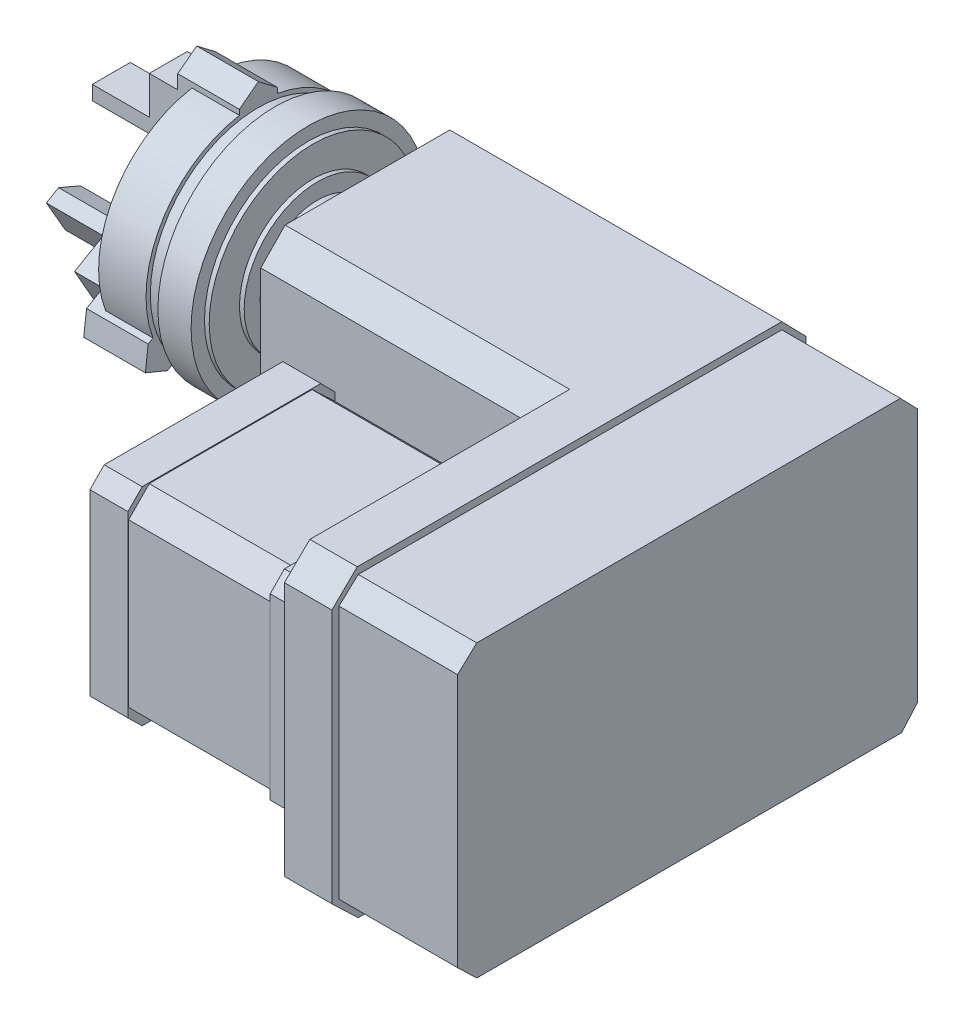
from build123d import *

# Parameters (mm, degrees)
BOSS_EXTRUDE1_DEPTH    = 60
CUT_EXTRUDE1_DEPTH     = 121.037494142
BOSS_EXTRUDE5_DEPTH    = 10
BOSS_EXTRUDE6_DEPTH    = 25
BOSS_EXTRUDE7_DEPTH    = 8
BOSS_EXTRUDE8_DEPTH    = 30
BOSS_EXTRUDE9_DEPTH    = 8
SKETCH8_R              = 4.044381725
CUT_EXTRUDE2_DEPTH     = 5
SKETCH9_R              = 15.487315424
CUT_EXTRUDE3_DEPTH     = 0.5
SKETCH10_R             = 11.178262473
BOSS_EXTRUDE10_DEPTH   = 3
SKETCH11_R             = 12.137000118
BOSS_EXTRUDE11_DEPTH   = 8
BOSS_EXTRUDE12_START   = 1
SKETCH12_R             = 15.487315424
BOSS_EXTRUDE12_DEPTH   = 1
SKETCH13_R             = 21.870620662
BOSS_EXTRUDE13_DEPTH   = 1
SKETCH14_R             = 24.68912304
BOSS_EXTRUDE14_DEPTH   = 7
SKETCH15_R             = 22.788184892
BOSS_EXTRUDE15_DEPTH   = 3.5
BOSS_EXTRUDE17_DEPTH   = 10
BOSS_EXTRUDE18_DEPTH   = 25
CUT_EXTRUDE4_DEPTH     = 12
CUT_EXTRUDE5_DEPTH     = 12
SKETCH20_W             = 8
SKETCH20_H             = 8
CUT_EXTRUDE6_DEPTH     = 6
BOSS_EXTRUDE19_DEPTH   = 12
BOSS_EXTRUDE19_2_DEPTH = 12
BOSS_EXTRUDE19_3_DEPTH = 12
CUT_EXTRUDE7_DEPTH     = 12
CUT_EXTRUDE8_DEPTH     = 1
CUT_EXTRUDE9_DEPTH     = 1
BOSS_EXTRUDE20_DEPTH   = 6


with BuildPart() as part:
    # Sketch1 → Boss-Extrude1 (new body)
    with BuildSketch(Plane(origin=(0, 0, 0), x_dir=(0, 0, -1), z_dir=(1, 0, 0))):
        Polygon((0, 8), (0, 0), (18.000733745, 0), (22.844437025, 5.141795141), (51.906656706, 5.141795141), (57, 0), (75, 0), (75, 8), (60, 8), (60, 66.734849184), (54.858204859, 72), (20.141795141, 72), (15, 66.734849184), (15, 8), align=None)
    extrude(amount=BOSS_EXTRUDE1_DEPTH)

    # Sketch2 → Cut-Extrude1 (cut, through all)
    with BuildSketch(Plane.XZ):
        with BuildLine():
            Line((55, -8), (55, 0))
            Line((55, 0), (47, 0))
            Line((47, 0), (47, -8))
            ThreePointArc((47, -8), (51, -12), (55, -8))
        make_face()
        with BuildLine():
            Line((13, 0), (5, 0))
            Line((5, 0), (5, -8))
            ThreePointArc((5, -8), (9, -12), (13, -8))
            Line((13, -8), (13, 0))
        make_face()
        with BuildLine():
            Line((47, -75), (55, -75))
            Line((55, -75), (55, -67))
            ThreePointArc((55, -67), (51, -63), (47, -67))
            Line((47, -67), (47, -75))
        make_face()
        with BuildLine():
            Line((5, -75), (13, -75))
            Line((13, -75), (13, -67))
            ThreePointArc((13, -67), (9, -63), (5, -67))
            Line((5, -67), (5, -75))
        make_face()
    extrude(amount=-CUT_EXTRUDE1_DEPTH, mode=Mode.SUBTRACT)

    # Sketch3 → Boss-Extrude5 (add)
    with BuildSketch(Plane(origin=(60, 0, 0), x_dir=(0, 0, -1), z_dir=(1, 0, 0))):
        Polygon((-40, 13.130427758), (-34.454678746, 7.813729324), (55.132936848, 7.813729324), (60, 13.21926496), (60, 66.734849184), (54.858204859, 72), (-34.64895923, 72), (-40, 66.774327195), align=None)
    extrude(amount=BOSS_EXTRUDE5_DEPTH)

    # Sketch4 → Boss-Extrude6 (add)
    with BuildSketch(Plane(origin=(70, 0, 0), x_dir=(0, 0, -1), z_dir=(1, 0, 0))):
        Polygon((-25.698394905, 70.5), (54.858204859, 70.5), (58.5, 66.734849184), (58.5, 39.977057072), (58.5, 13.21926496), (55.132936848, 9.313729324), (22.74008343, 9.313729324), (-34.454678746, 9.313729324), (-38.5, 13.21926496), (-38.5, 39.952377476), (-38.5, 66.734849184), (-34.454678746, 70.5), align=None)
    extrude(amount=BOSS_EXTRUDE6_DEPTH)

    # Sketch5 → Boss-Extrude7 (add)
    with BuildSketch(Plane.ZY.offset(-60)):
        Polygon((35, 20.563642038), (35, 58.244850637), (32, 61.296911147), (27.576585988, 61.296911147), (-5.67, 61.296911147), (-8.67, 58.244850637), (-8.67, 20.563642038), (-5.67, 17.628968471), (23.350656051, 17.628968471), (32, 17.628968471), align=None)
    extrude(amount=BOSS_EXTRUDE7_DEPTH)

    # Sketch6 → Boss-Extrude8 (add)
    with BuildSketch(Plane.ZY.offset(-52)):
        Polygon((34.858186176, 22.424916278), (34.858186176, 56.68012364), (30.510716808, 61.103036832), (-3.83089655, 61.103036832), (-8.528186176, 56.669693972), (-8.528186176, 22.424916278), (-3.871605337, 17.869734711), (30.201605337, 17.869734711), align=None)
    extrude(amount=BOSS_EXTRUDE8_DEPTH)

    # Sketch7 → Boss-Extrude9 (add)
    with BuildSketch(Plane.ZY.offset(-22)):
        Polygon((-8.67, 58.244850637), (-5.67, 61.296911147), (32, 61.296911147), (35, 58.244850637), (35, 20.563642038), (32, 17.628968471), (-5.67, 17.628968471), (-8.67, 20.563642038), align=None)
    extrude(amount=BOSS_EXTRUDE9_DEPTH)

    # Sketch8 → Cut-Extrude2 (cut)
    with BuildSketch(Plane.ZY.offset(-14)):
        with Locations((13.165, 39.404246338)):
            Circle(SKETCH8_R)
    extrude(amount=-CUT_EXTRUDE2_DEPTH, mode=Mode.SUBTRACT)

    # Sketch9 → Cut-Extrude3 (cut)
    with BuildSketch(Plane.ZY):
        with Locations((-37.5, 50.497312421)):
            Circle(SKETCH9_R)
    extrude(amount=-CUT_EXTRUDE3_DEPTH, mode=Mode.SUBTRACT)

    # Sketch10 → Boss-Extrude10 (add)
    with BuildSketch(Plane.ZY.offset(-0.5)):
        with Locations((-37.5, 50.497312421)):
            Circle(SKETCH10_R)
    extrude(amount=BOSS_EXTRUDE10_DEPTH)

    # Sketch11 → Boss-Extrude11 (add)
    with BuildSketch(Plane.ZY.offset(2.5)):
        with Locations((-37.5, 50.497312421)):
            Circle(SKETCH11_R)
    extrude(amount=BOSS_EXTRUDE11_DEPTH)

    # Sketch12 → Boss-Extrude12 (add)
    with BuildSketch(Plane.ZY.offset(10.5).offset(BOSS_EXTRUDE12_START)):
        with Locations((-37.5, 50.497312421)):
            Circle(SKETCH12_R)
    extrude(amount=-BOSS_EXTRUDE12_DEPTH)

    # Sketch13 → Boss-Extrude13 (add)
    with BuildSketch(Plane.ZY.offset(11.5)):
        with Locations((-37.5, 50.497312421)):
            Circle(SKETCH13_R)
    extrude(amount=BOSS_EXTRUDE13_DEPTH)

    # Sketch14 → Boss-Extrude14 (add)
    with BuildSketch(Plane.ZY.offset(12.5)):
        with Locations((-37.5, 50.497312421)):
            Circle(SKETCH14_R)
    extrude(amount=BOSS_EXTRUDE14_DEPTH)

    # Sketch15 → Boss-Extrude15 (add)
    with BuildSketch(Plane.ZY.offset(19.5)):
        with Locations((-37.5, 50.497312421)):
            Circle(SKETCH15_R)
    extrude(amount=BOSS_EXTRUDE15_DEPTH)

    # Sketch16 → Boss-Extrude17 (add)
    with BuildSketch(Plane.ZY.offset(23)):
        with BuildLine():
            ThreePointArc((-33.5, 58.009256763), (-30.12965531, 54.752582912), (-28.994465367, 50.205441864))
            Line((-28.994465367, 50.205441864), (-15.28400459, 42.289703644))
            ThreePointArc((-15.28400459, 42.289703644), (-16.989357143, 62.339137595), (-33.5, 73.840733204))
            Line((-33.5, 73.840733204), (-33.5, 58.009256763))
        make_face()
        with BuildLine():
            ThreePointArc((-46.005534633, 50.205441864), (-44.87034469, 54.752582912), (-41.5, 58.009256763))
            Line((-41.5, 58.009256763), (-41.5, 73.840733204))
            ThreePointArc((-41.5, 73.840733204), (-58.010642857, 62.339137595), (-59.71599541, 42.289703644))
            Line((-59.71599541, 42.289703644), (-46.005534633, 50.205441864))
        make_face()
        with BuildLine():
            ThreePointArc((-32.994465367, 43.277238634), (-37.5, 41.986771438), (-42.005534633, 43.277238634))
            Line((-42.005534633, 43.277238634), (-55.737647351, 35.34899966))
            ThreePointArc((-55.737647351, 35.34899966), (-37.5, 26.789019348), (-19.262352649, 35.34899966))
            Line((-19.262352649, 35.34899966), (-32.994465367, 43.277238634))
        make_face()
    extrude(amount=BOSS_EXTRUDE17_DEPTH)

    # Sketch17 → Boss-Extrude18 (add)
    with BuildSketch(Plane.ZY.offset(23)):
        Polygon((-41.5, 60.998662041), (-37.5, 58.009256763), (-33.5, 60.998662041), (-33.5, 74.954597667), (-37.5, 78.009256763), (-41.5, 74.954597667), align=None)
        Polygon((-26.387162336, 48.700114757), (-30.994465367, 46.741340249), (-30.269261267, 41.703841313), (-18.337601836, 34.815094529), (-13.673957292, 36.741340249), (-14.269261267, 41.703841313), align=None)
        Polygon((-44.730738733, 41.703841313), (-44.005534633, 46.741340249), (-48.612837664, 48.700114757), (-60.730738733, 41.703841313), (-61.326042708, 36.741340249), (-56.662398164, 34.815094529), align=None)
    extrude(amount=BOSS_EXTRUDE18_DEPTH)

    # Sketch18 → Cut-Extrude4 (cut)
    with BuildSketch(Plane.ZY.offset(48)):
        Polygon((-44.730738733, 41.703841313), (-44.005534633, 46.741340249), (-48.612837664, 48.700114757), (-51.201687055, 47.205441864), (-47.201687055, 40.277238634), align=None)
    extrude(amount=-CUT_EXTRUDE4_DEPTH, mode=Mode.SUBTRACT)

    # Sketch19 → Cut-Extrude5 (cut)
    with BuildSketch(Plane.ZY.offset(48)):
        Polygon((-26.387162336, 48.700114757), (-30.994465367, 46.741340249), (-30.269261267, 41.703841313), (-27.798312945, 40.277238634), (-23.798312945, 47.205441864), align=None)
        Polygon((-41.5, 60.998662041), (-37.5, 58.009256763), (-33.5, 60.998662041), (-33.5, 64.009256763), (-41.5, 64.009256763), align=None)
    extrude(amount=-CUT_EXTRUDE5_DEPTH, mode=Mode.SUBTRACT)

    # Sketch20 → Cut-Extrude6 (cut)
    with BuildSketch(Plane.ZY.offset(48)):
        with Locations((-37.5, 68.009256763)):
            Rectangle(SKETCH20_W, SKETCH20_H)
        Polygon((-20.835583463, 36.257304894), (-18.870109714, 39.741340249), (-16.870109714, 43.205441864), (-23.798312945, 47.205441864), (-27.798312945, 40.277238634), align=None)
        Polygon((-58.129890286, 43.205441864), (-54.129890286, 36.277238634), (-47.201687055, 40.277238634), (-51.201687055, 47.205441864), align=None)
    extrude(amount=-CUT_EXTRUDE6_DEPTH, mode=Mode.SUBTRACT)

    # Sketch22 → Cut-Extrude7 (cut)
    with BuildSketch(Plane.ZY.offset(48)):
        Polygon((-58.129890286, 43.205441864), (-54.129890286, 36.277238634), (-56.662398164, 34.815094529), (-61.326042708, 36.741340249), (-60.730738733, 41.703841313), align=None)
        Polygon((-20.835583463, 36.257304894), (-16.870109714, 43.205441864), (-14.269261267, 41.703841313), (-13.673957292, 36.741340249), (-18.337601836, 34.815094529), align=None)
        Polygon((-41.5, 74.954597667), (-37.5, 78.009256763), (-33.5, 74.954597667), (-33.5, 72.009256763), (-41.5, 72.009256763), align=None)
    extrude(amount=-CUT_EXTRUDE7_DEPTH, mode=Mode.SUBTRACT)

    # Sketch23 → Cut-Extrude8 (cut)
    with BuildSketch(Plane(origin=(0, 17.878010797, -31.325101527), x_dir=(1, 0, 0), z_dir=(0, -0.49567806364879385, 0.8685063368895948))):
        Polygon((-48, 29.201923716), (-36, 29.147090659), (-36, 21.147583248), (-48, 21.161957393), align=None)
    extrude(amount=-CUT_EXTRUDE8_DEPTH, mode=Mode.SUBTRACT)

    # Sketch24 → Cut-Extrude9 (cut)
    with BuildSketch(Plane(origin=(0.132430911, 25.171038803, 14.365734876), x_dir=(0.9999895603571438, -0.003968530082114351, -0.0022649383465402294), z_dir=(-0.00456937377835026, -0.8684972699936193, -0.4956728889468378))):
        Polygon((-40.498725216, -37.067786953), (-39.408108569, -36.067786953), (-36.132808125, -36.067786953), (-36.132808125, -37.067786953), align=None)
    extrude(amount=-CUT_EXTRUDE9_DEPTH, mode=Mode.SUBTRACT)



with BuildPart() as body_2:
    # Sketch21 → Boss-Extrude19 (new body)
    with BuildSketch(Plane.ZY.offset(42)):
        Polygon((-41.5, 64.009256763), (-33.5, 64.009256763), (-33.5, 60.998662041), (-37.5, 58.009256763), (-41.5, 60.998662041), align=None)
    extrude(amount=BOSS_EXTRUDE19_DEPTH)


with BuildPart() as body_3:
    # Sketch21 → Boss-Extrude19 2 (new body)
    with BuildSketch(Plane.ZY.offset(42)):
        Polygon((-26.387162336, 48.700114757), (-23.798312945, 47.205441864), (-27.798312945, 40.277238634), (-30.269261267, 41.703841313), (-30.994465367, 46.741340249), align=None)
    extrude(amount=BOSS_EXTRUDE19_2_DEPTH)


with BuildPart() as body_4:
    # Sketch21 → Boss-Extrude19 3 (new body)
    with BuildSketch(Plane.ZY.offset(42)):
        Polygon((-51.201687055, 47.205441864), (-48.612837664, 48.700114757), (-44.005534633, 46.741340249), (-44.730738733, 41.703841313), (-47.201687055, 40.277238634), align=None)
    extrude(amount=BOSS_EXTRUDE19_3_DEPTH)


with BuildPart() as part_1:
    add(part.part)

    add(body_2.part)  # Boss-Extrude20 merges body 2

    add(body_3.part)  # Boss-Extrude20 merges body 3

    add(body_4.part)  # Boss-Extrude20 merges body 4
    # Sketch26 → Boss-Extrude20 (add)
    with BuildSketch(Plane.ZY.offset(36)):
        Polygon((-41.5, 64.009256763), (-33.5, 64.009256763), (-33.5, 60.998662041), (-37.5, 58.009256763), (-41.5, 60.998662041), align=None)
        Polygon((-26.387162336, 48.700114757), (-23.798312945, 47.205441864), (-27.798312945, 40.277238634), (-30.269261267, 41.703841313), (-30.994465367, 46.741340249), align=None)
        Polygon((-51.201687055, 47.205441864), (-48.612837664, 48.700114757), (-44.005534633, 46.741340249), (-44.730738733, 41.703841313), (-47.201687055, 40.277238634), align=None)
    extrude(amount=BOSS_EXTRUDE20_DEPTH)


solid = part_1.part
